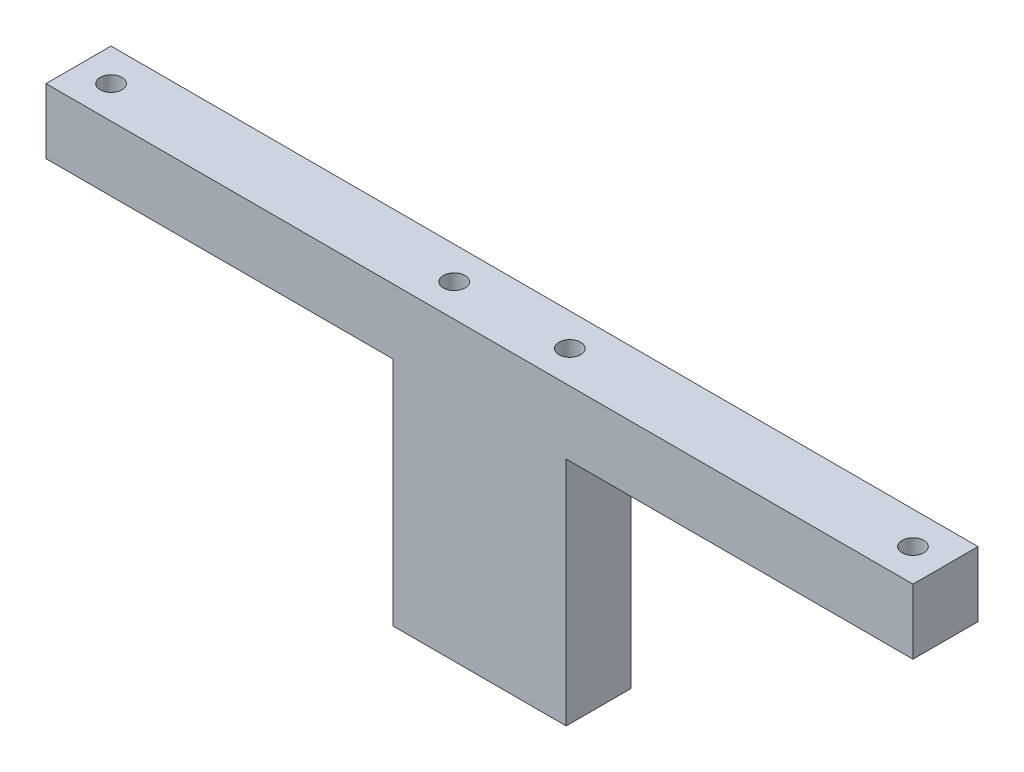
from build123d import *

# Parameters (mm, degrees)
SKETCH1_W           = 381
SKETCH1_H           = 28.575
SKETCH1_W_2         = 76.2
SKETCH1_H_2         = 101.6
BOSS_EXTRUDE1_DEPTH = 28.575
SKETCH2_R           = 4.7625
CUT_EXTRUDE1_DEPTH  = 233.491529416


with BuildPart() as part:
    # Sketch1 → Boss-Extrude1 (new body)
    with BuildSketch(Plane.XY):
        with Locations((0, -14.2875)):
            Rectangle(SKETCH1_W, SKETCH1_H)
        with Locations((0, -79.375)):
            Rectangle(SKETCH1_W_2, SKETCH1_H_2)
    extrude(amount=BOSS_EXTRUDE1_DEPTH)

    # Sketch2 → Cut-Extrude1 (cut, through all)
    with BuildSketch(Plane(origin=(0, 0, 0), x_dir=(1, 0, 0), z_dir=(0, 1, 0))):
        with Locations(Location((-176.2125, -14.2875, 0), (0, 0, 270))):
            Circle(SKETCH2_R)
        with Locations(Location((-25.4, -14.2875, 0), (0, 0, 270))):
            Circle(SKETCH2_R)
        with Locations(Location((25.4, -14.2875, 0), (0, 0, 90))):
            Circle(SKETCH2_R)
        with Locations(Location((176.2125, -14.2875, 0), (0, 0, 270))):
            Circle(SKETCH2_R)
    extrude(amount=-CUT_EXTRUDE1_DEPTH, mode=Mode.SUBTRACT)


solid = part.part
